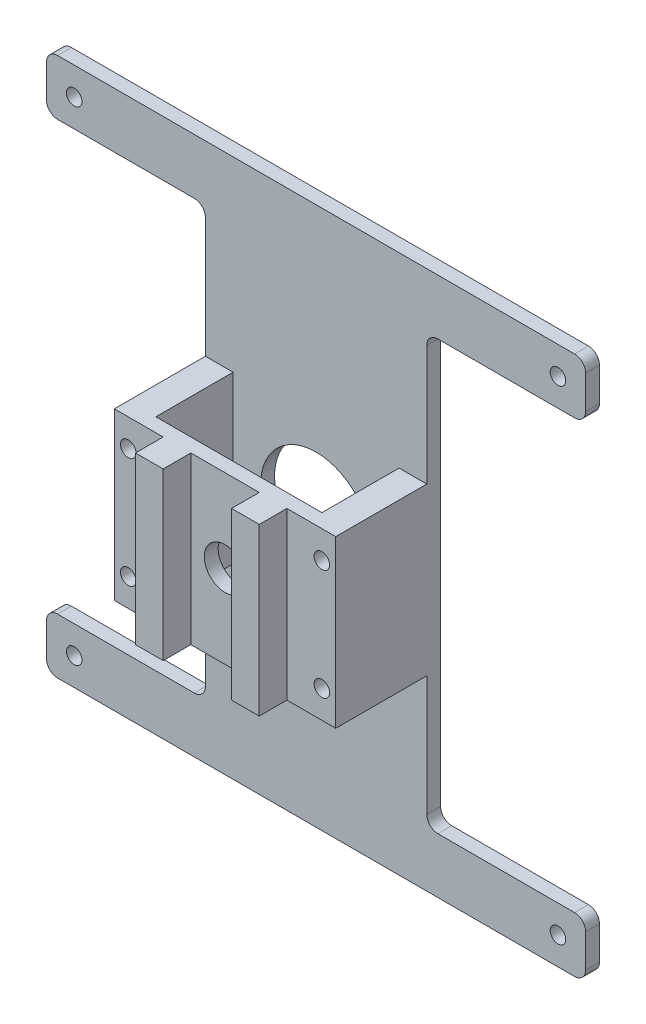
from build123d import *

# Parameters (mm, degrees)
SKETCH1_R           = 1.7859375
SKETCH1_R_2         = 12.7
BOSS_EXTRUDE1_DEPTH = 3.175
SKETCH2_W           = 6.35
SKETCH2_H           = 38.1
BOSS_EXTRUDE2_DEPTH = 17.7165
SKETCH3_W           = 50.8
SKETCH3_H           = 38.1
SKETCH3_R           = 4.7625
BOSS_EXTRUDE3_DEPTH = 3.175
SKETCH4_W           = 6.35
SKETCH4_H           = 38.1
BOSS_EXTRUDE4_DEPTH = 6.35
FILLET1_R           = 2.54
CUT_EXTRUDE2_REACH  = 94.617
SKETCH6_R           = 1.7859375


with BuildPart() as part:
    # Sketch1 → Boss-Extrude1 (new body)
    with BuildSketch(Plane.XY):
        Polygon((25.4, -19.05), (25.4, 49.157882323), (61.857882323, 49.157882323), (61.857882323, 61.857882323), (19.05, 61.857882323), (-19.05, 61.857882323), (-61.857882323, 61.857882323), (-61.857882323, 49.157882323), (-25.4, 49.157882323), (-25.4, -19.05), (-25.4, -49.157882323), (-61.857882323, -49.157882323), (-61.857882323, -61.857882323), (-19.05, -61.857882323), (19.05, -61.857882323), (61.857882323, -61.857882323), (61.857882323, -49.157882323), (25.4, -49.157882323), align=None)
        with Locations((-55.507882323, -55.507882323)):
            Circle(SKETCH1_R, mode=Mode.SUBTRACT)
        with Locations((55.507882323, -55.507882323)):
            Circle(SKETCH1_R, mode=Mode.SUBTRACT)
        Circle(SKETCH1_R_2, mode=Mode.SUBTRACT)
        with Locations((-55.507882323, 55.507882323)):
            Circle(SKETCH1_R, mode=Mode.SUBTRACT)
        with Locations((55.507882323, 55.507882323)):
            Circle(SKETCH1_R, mode=Mode.SUBTRACT)
    extrude(amount=BOSS_EXTRUDE1_DEPTH)

    # Sketch2 → Boss-Extrude2 (add)
    with BuildSketch(Plane.XY.offset(3.175)):
        with Locations((22.225, 0)):
            Rectangle(SKETCH2_W, SKETCH2_H)
        with Locations((-22.225, 0)):
            Rectangle(SKETCH2_W, SKETCH2_H)
    extrude(amount=BOSS_EXTRUDE2_DEPTH)

    # Sketch3 → Boss-Extrude3 (add)
    with BuildSketch(Plane.XY.offset(20.8915)):
        Rectangle(SKETCH3_W, SKETCH3_H)
        Circle(SKETCH3_R, mode=Mode.SUBTRACT)
    extrude(amount=BOSS_EXTRUDE3_DEPTH)

    # Sketch4 → Boss-Extrude4 (add)
    with BuildSketch(Plane.XY.offset(24.0665)):
        with Locations((11.0236, 0)):
            Rectangle(SKETCH4_W, SKETCH4_H)
        with Locations((-11.0236, 0)):
            Rectangle(SKETCH4_W, SKETCH4_H)
    extrude(amount=BOSS_EXTRUDE4_DEPTH)

    # Fillet1
    fillet1_edges = [part.edges().sort_by_distance(p)[0] for p in [
        (61.857882323, -49.157882323, 1.5875),
        (61.857882323, -61.857882323, 1.5875),
        (-61.857882323, -61.857882323, 1.5875),
        (-61.857882323, -49.157882323, 1.5875),
        (-25.4, -49.157882323, 1.5875),
        (-25.4, 49.157882323, 1.5875),
        (-61.857882323, 49.157882323, 1.5875),
        (-61.857882323, 61.857882323, 1.5875),
        (61.857882323, 61.857882323, 1.5875),
        (61.857882323, 49.157882323, 1.5875),
        (25.4, 49.157882323, 1.5875),
        (25.4, -49.157882323, 1.5875),
    ]]
    fillet(fillet1_edges, radius=FILLET1_R)

    # Sketch6 → Cut-Extrude2 (cut, up to next)
    with BuildSketch(Plane(origin=(0, 0, 0), x_dir=(-1, 0, 0), z_dir=(0, 0, -1)), mode=Mode.PRIVATE) as cut_extrude2_sk1:
        with Locations((-22.225, -12.7)):
            Circle(SKETCH6_R)
    cut_extrude2_tool1 = extrude(cut_extrude2_sk1.sketch, amount=-CUT_EXTRUDE2_REACH, mode=Mode.PRIVATE) & part.part
    # Sketch6 → Cut-Extrude2 (cut, up to next)
    with BuildSketch(Plane(origin=(0, 0, 0), x_dir=(-1, 0, 0), z_dir=(0, 0, -1)), mode=Mode.PRIVATE) as cut_extrude2_sk2:
        with Locations((-22.225, 12.7)):
            Circle(SKETCH6_R)
    cut_extrude2_tool2 = extrude(cut_extrude2_sk2.sketch, amount=-CUT_EXTRUDE2_REACH, mode=Mode.PRIVATE) & part.part
    # Sketch6 → Cut-Extrude2 (cut, up to next)
    with BuildSketch(Plane(origin=(0, 0, 0), x_dir=(-1, 0, 0), z_dir=(0, 0, -1)), mode=Mode.PRIVATE) as cut_extrude2_sk3:
        with Locations((22.225, 12.7)):
            Circle(SKETCH6_R)
    cut_extrude2_tool3 = extrude(cut_extrude2_sk3.sketch, amount=-CUT_EXTRUDE2_REACH, mode=Mode.PRIVATE) & part.part
    # Sketch6 → Cut-Extrude2 (cut, up to next)
    with BuildSketch(Plane(origin=(0, 0, 0), x_dir=(-1, 0, 0), z_dir=(0, 0, -1)), mode=Mode.PRIVATE) as cut_extrude2_sk4:
        with Locations((22.225, -12.7)):
            Circle(SKETCH6_R)
    cut_extrude2_tool4 = extrude(cut_extrude2_sk4.sketch, amount=-CUT_EXTRUDE2_REACH, mode=Mode.PRIVATE) & part.part
    add(cut_extrude2_tool1.solids().sort_by_distance((22.225, -12.7, 0))[0], mode=Mode.SUBTRACT)
    add(cut_extrude2_tool2.solids().sort_by_distance((22.225, 12.7, 0))[0], mode=Mode.SUBTRACT)
    add(cut_extrude2_tool3.solids().sort_by_distance((-22.225, 12.7, 0))[0], mode=Mode.SUBTRACT)
    add(cut_extrude2_tool4.solids().sort_by_distance((-22.225, -12.7, 0))[0], mode=Mode.SUBTRACT)


solid = part.part
